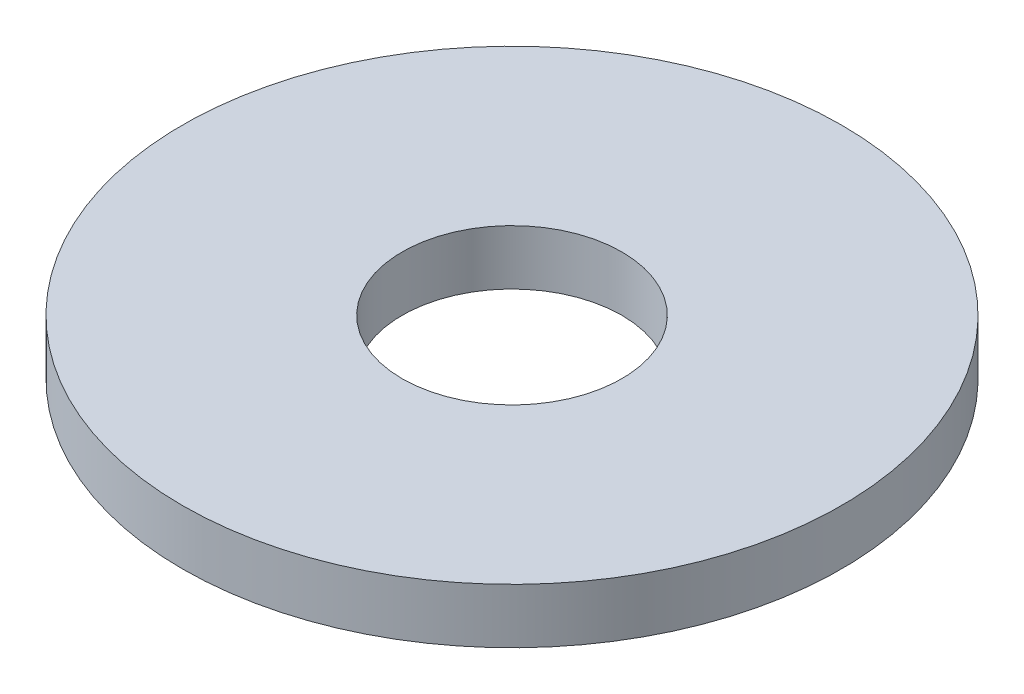
from build123d import *

# Parameters (mm, degrees)
SKETCH_1_R      = 6
SKETCH_1_R_2    = 2
EXTRUDE_1_DEPTH = 1


with BuildPart() as part:
    # 草图1 → 凸台-拉伸1 (new body)
    with BuildSketch(Plane(origin=(0, 0, 0), x_dir=(1, 0, 0), z_dir=(0, 1, 0))):
        with Locations(Location((0, 0, 0), (0, 0, 270))):
            Circle(SKETCH_1_R)
        with Locations(Location((0, 0, 0), (0, 0, 270))):
            Circle(SKETCH_1_R_2, mode=Mode.SUBTRACT)
    extrude(amount=EXTRUDE_1_DEPTH)


solid = part.part
